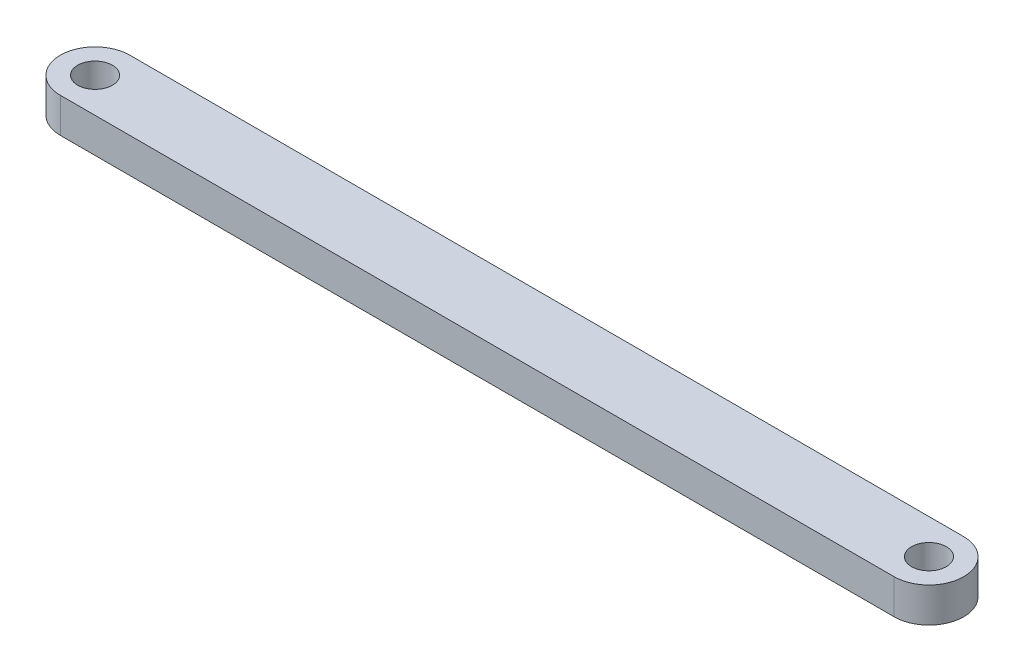
from build123d import *

# Parameters (mm, degrees)
SKETCH1_R           = 63.5
BOSS_EXTRUDE1_DEPTH = 127


with BuildPart() as part:
    # Sketch1 → Boss-Extrude1 (new body)
    with BuildSketch(Plane(origin=(0, 0, 0), x_dir=(1, 0, 0), z_dir=(0, 1, 0))):
        with BuildLine():
            Line((0, 127), (3048, 127))
            ThreePointArc((3048, 127), (3175, 0), (3048, -127))
            Line((3048, -127), (0, -127))
            ThreePointArc((0, -127), (-127, 0), (0, 127))
        make_face()
        with Locations(Location((0, 0, 0), (0, 0, 270))):
            Circle(SKETCH1_R, mode=Mode.SUBTRACT)
        with Locations(Location((3048, 0, 0), (0, 0, 270))):
            Circle(SKETCH1_R, mode=Mode.SUBTRACT)
    extrude(amount=BOSS_EXTRUDE1_DEPTH)


solid = part.part
